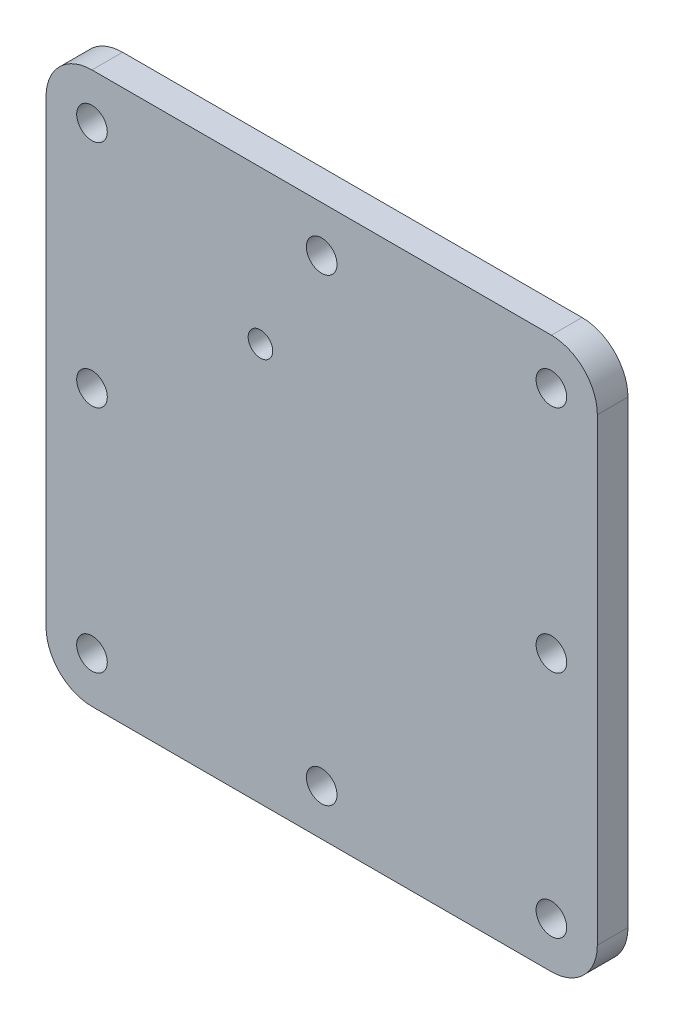
from build123d import *

# Parameters (mm, degrees)
SKETCH2_R           = 5
BOSS_EXTRUDE1_DEPTH = 10
SKETCH5_R           = 4
CUT_EXTRUDE4_DEPTH  = 10


with BuildPart() as part:
    # Sketch2 → Boss-Extrude1 (new body)
    with BuildSketch(Plane.XY):
        with BuildLine():
            Line((-75, 90), (75, 90))
            ThreePointArc((75, 90), (85.606601718, 85.606601718), (90, 75))
            Line((90, 75), (90, -75))
            ThreePointArc((90, -75), (85.606601718, -85.606601718), (75, -90))
            Line((75, -90), (-75, -90))
            ThreePointArc((-75, -90), (-85.606601718, -85.606601718), (-90, -75))
            Line((-90, -75), (-90, 75))
            ThreePointArc((-90, 75), (-85.606601718, 85.606601718), (-75, 90))
        make_face()
        with Locations((-75, 75)):
            Circle(SKETCH2_R, mode=Mode.SUBTRACT)
        with Locations((0, 75)):
            Circle(SKETCH2_R, mode=Mode.SUBTRACT)
        with Locations((75, 75)):
            Circle(SKETCH2_R, mode=Mode.SUBTRACT)
        with Locations((-75, 0)):
            Circle(SKETCH2_R, mode=Mode.SUBTRACT)
        with Locations((75, 0)):
            Circle(SKETCH2_R, mode=Mode.SUBTRACT)
        with Locations((-75, -75)):
            Circle(SKETCH2_R, mode=Mode.SUBTRACT)
        with Locations((0, -75)):
            Circle(SKETCH2_R, mode=Mode.SUBTRACT)
        with Locations((75, -75)):
            Circle(SKETCH2_R, mode=Mode.SUBTRACT)
    extrude(amount=BOSS_EXTRUDE1_DEPTH)

    # Sketch5 → Cut-Extrude4 (cut)
    with BuildSketch(Plane.XY.offset(10)):
        with Locations((-20, 40)):
            Circle(SKETCH5_R)
    extrude(amount=-CUT_EXTRUDE4_DEPTH, mode=Mode.SUBTRACT)


solid = part.part
